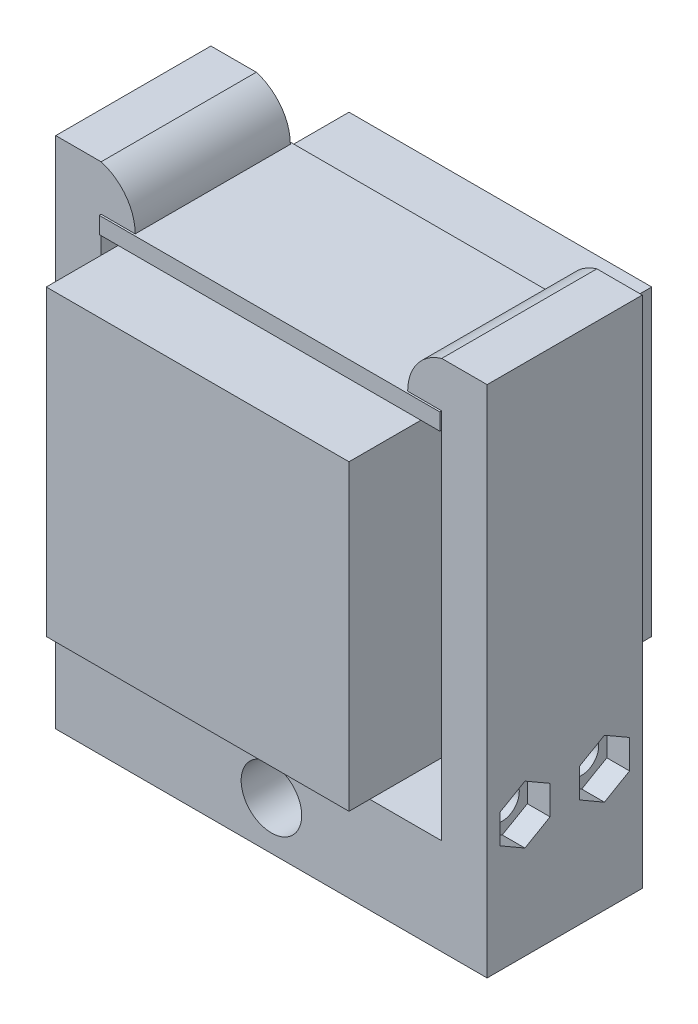
from build123d import *

# Parameters (mm, degrees)
SKETCH1_W           = 45
SKETCH1_H           = 21
BOSS_EXTRUDE1_DEPTH = 2.2
SKETCH2_W           = 40
SKETCH2_H           = 40
BOSS_EXTRUDE2_DEPTH = 40
SKETCH3_W           = 45
SKETCH3_H           = 12.7
SKETCH3_R           = 4
BOSS_EXTRUDE3_DEPTH = 10.25
SKETCH6_R           = 2.25
CUT_EXTRUDE1_DEPTH  = 85.929912281
CUT_EXTRUDE2_DEPTH  = 3


with BuildPart() as part:
    # Sketch1 → Boss-Extrude1 (new body)
    with BuildSketch(Plane(origin=(0, 0, 0), x_dir=(1, 0, 0), z_dir=(0, 1, 0))):
        Rectangle(SKETCH1_W, SKETCH1_H)
    extrude(amount=BOSS_EXTRUDE1_DEPTH)


with BuildPart() as body_2:
    # Sketch2 → Boss-Extrude2 (new body)
    with BuildSketch(Plane(origin=(0, 0, 0), x_dir=(1, 0, 0), z_dir=(0, 1, 0))):
        Rectangle(SKETCH2_W, SKETCH2_H)
    extrude(amount=-BOSS_EXTRUDE2_DEPTH)


with BuildPart() as body_3:
    # Sketch3 → Boss-Extrude3 (new, symmetric)
    # profile 1 of 3: a face of its own
    with BuildSketch(Plane.XY):
        with Locations((0, -53.35)):
            Rectangle(SKETCH3_W, SKETCH3_H)
        with Locations((0, -53.35)):
            Circle(SKETCH3_R, mode=Mode.SUBTRACT)
    # profile 2 of 3: a face of its own
    with BuildSketch(Plane.XY):
        with BuildLine():
            Line((-28.5, -59.7), (-22.5, -59.7))
            Line((-22.5, -59.7), (-22.5, -47))
            Line((-22.5, -47), (-22.5, 0))
            Line((-22.5, 0), (-22.5, 2.2))
            Line((-22.5, 2.2), (-18, 2.2))
            ThreePointArc((-18, 2.2), (-19.25, 5.95), (-22.5, 8.2))
            Line((-22.5, 8.2), (-28.5, 8.2))
            Line((-28.5, 8.2), (-28.5, 0))
            Line((-28.5, 0), (-28.5, -59.7))
        make_face()
    # profile 3 of 3: a face of its own
    with BuildSketch(Plane.XY):
        with BuildLine():
            Line((22.5, -47), (22.5, -59.7))
            Line((22.5, -59.7), (28.5, -59.7))
            Line((28.5, -59.7), (28.5, 0))
            Line((28.5, 0), (28.5, 8.2))
            Line((28.5, 8.2), (22.5, 8.2))
            ThreePointArc((22.5, 8.2), (19.25, 5.95), (18, 2.2))
            Line((18, 2.2), (22.5, 2.2))
            Line((22.5, 2.2), (22.5, 0))
            Line((22.5, 0), (22.5, -47))
        make_face()
    extrude(amount=BOSS_EXTRUDE3_DEPTH, both=True)

    # Sketch6 → Cut-Extrude1 (cut, through all)
    with BuildSketch(Plane(origin=(28.5, 0, 0), x_dir=(0, 0, -1), z_dir=(1, 0, 0))):
        with Locations((-5.25, -43.5)):
            Circle(SKETCH6_R)
        with Locations(Location((5.25, -43.5, 0), (0, 0, 180))):
            Circle(SKETCH6_R)
    extrude(amount=-CUT_EXTRUDE1_DEPTH, mode=Mode.SUBTRACT)

    # Sketch7 → Cut-Extrude2 (cut)
    with BuildSketch(Plane(origin=(28.5, 0, 0), x_dir=(0, 0, -1), z_dir=(1, 0, 0))):
        Polygon((-8.566877296, -41.585), (-5.25, -39.67), (-1.933122704, -41.585), (-1.933122704, -45.415), (-5.25, -47.33), (-8.566877296, -45.415), align=None)
        Polygon((1.933122704, -41.585), (1.933122704, -45.415), (5.25, -47.33), (8.566877296, -45.415), (8.566877296, -41.585), (5.25, -39.67), align=None)
    extrude(amount=-CUT_EXTRUDE2_DEPTH, mode=Mode.SUBTRACT)


solid = Compound([part.part, body_2.part, body_3.part])
